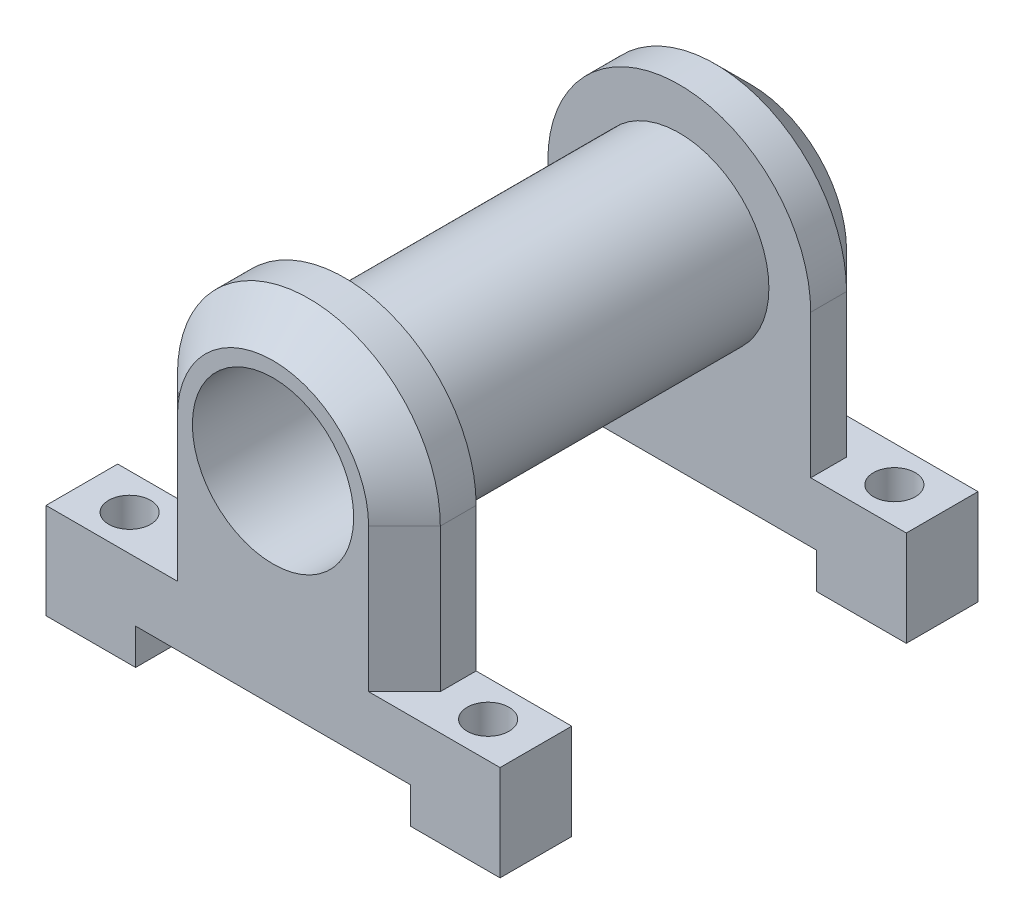
from build123d import *

# Parameters (mm, degrees)
BOSS_EXTRUDE1_DEPTH     = 6
SKETCH2_R               = 7.5
BOSS_EXTRUDE2_DEPTH     = 28
BOSS_EXTRUDE3_DEPTH     = 6
SKETCH4_R               = 6.75
CUT_EXTRUDE1_DEPTH      = 49.590122453
CUT_EXTRUDE2_DEPTH      = 49.590122453
CUT_EXTRUDE2_DEPTH_BACK = 49.590122453
SKETCH5_W               = 23
SKETCH5_H               = 3
SKETCH6_R               = 1.75
CUT_EXTRUDE3_DEPTH      = 50.899899799
CHAMFER1_SIZE           = 3


with BuildPart() as part:
    # Sketch1 → Boss-Extrude1 (new body)
    with BuildSketch(Plane.XY):
        with BuildLine():
            Line((-11, 0), (-11, -12))
            Line((-11, -12), (-19, -12))
            Line((-19, -12), (-19, -20))
            Line((-19, -20), (-11, -20))
            Line((-11, -20), (11, -20))
            Line((11, -20), (19, -20))
            Line((19, -20), (19, -12))
            Line((19, -12), (11, -12))
            Line((11, -12), (11, 0))
            ThreePointArc((11, 0), (0, 11), (-11, 0))
        make_face()
    extrude(amount=BOSS_EXTRUDE1_DEPTH)

    # Sketch2 → Boss-Extrude2 (add)
    with BuildSketch(Plane.XY.offset(6)):
        Circle(SKETCH2_R)
    extrude(amount=BOSS_EXTRUDE2_DEPTH)

    # Sketch3 → Boss-Extrude3 (add)
    with BuildSketch(Plane.XY.offset(34)):
        with BuildLine():
            Line((-11, 0), (-11, -12))
            Line((-11, -12), (-19, -12))
            Line((-19, -12), (-19, -20))
            Line((-19, -20), (19, -20))
            Line((19, -20), (19, -12))
            Line((19, -12), (11, -12))
            Line((11, -12), (11, 0))
            ThreePointArc((11, 0), (0, 11), (-11, 0))
        make_face()
    extrude(amount=BOSS_EXTRUDE3_DEPTH)

    # Sketch4 → Cut-Extrude1 (cut, through all)
    with BuildSketch(Plane.XY.offset(40)):
        Circle(SKETCH4_R)
    extrude(amount=-CUT_EXTRUDE1_DEPTH, mode=Mode.SUBTRACT)

    # Sketch5 → Cut-Extrude2 (cut, two sides: drawn at the far end of the back side and taken through both)
    with BuildSketch(Plane(origin=(0, 0, 0), x_dir=(-1, 0, 0), z_dir=(0, 0, -1)).offset(-CUT_EXTRUDE2_DEPTH_BACK)):
        with Locations((0, -18.5)):
            Rectangle(SKETCH5_W, SKETCH5_H)
    extrude(amount=CUT_EXTRUDE2_DEPTH + CUT_EXTRUDE2_DEPTH_BACK, mode=Mode.SUBTRACT)

    # Sketch6 → Cut-Extrude3 (cut, through all)
    with BuildSketch(Plane(origin=(0, -12, 0), x_dir=(1, 0, 0), z_dir=(0, 1, 0))):
        with Locations(Location((-15, -3, 0), (0, 0, 270))):
            Circle(SKETCH6_R)
        with Locations(Location((15, -3, 0), (0, 0, 270))):
            Circle(SKETCH6_R)
        with Locations(Location((15, -37, 0), (0, 0, 270))):
            Circle(SKETCH6_R)
        with Locations(Location((-15, -37, 0), (0, 0, 270))):
            Circle(SKETCH6_R)
    extrude(amount=-CUT_EXTRUDE3_DEPTH, mode=Mode.SUBTRACT)

    # Chamfer1
    chamfer1_edges = [part.edges().sort_by_distance(p)[0] for p in [
        (-11, -6, 0),
        (0, 11, 0),
        (11, -6, 0),
        (11, -6, 40),
        (0, 11, 40),
        (-11, -6, 40),
    ]]
    chamfer(chamfer1_edges, length=CHAMFER1_SIZE)


solid = part.part
